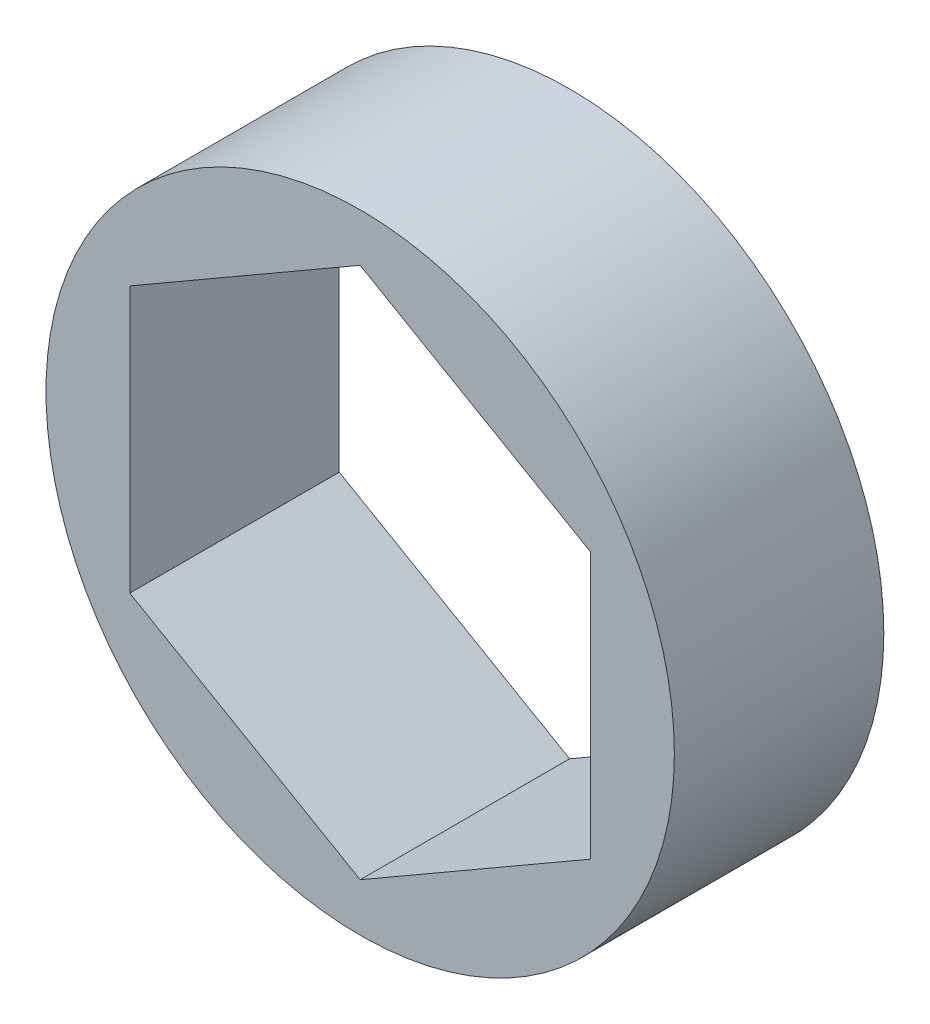
from build123d import *

# Parameters (mm, degrees)
SKETCH1_R           = 9.525
BOSS_EXTRUDE1_DEPTH = 3.175


with BuildPart() as part:
    # Sketch1 → Boss-Extrude1 (new, symmetric)
    with BuildSketch(Plane.XY):
        Circle(SKETCH1_R)
        Polygon((0, 8.065583261), (-6.985, 4.03279163), (-6.985, -4.03279163), (0, -8.065583261), (6.985, -4.03279163), (6.985, 4.03279163), align=None, mode=Mode.SUBTRACT)
    extrude(amount=BOSS_EXTRUDE1_DEPTH, both=True)


solid = part.part
